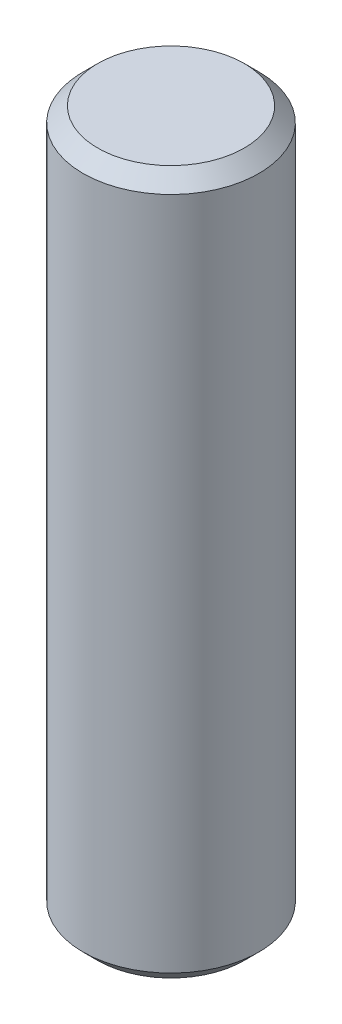
from build123d import *

# Parameters (mm, degrees)
SKETCH_1_W     = 1.5
SKETCH_1_H     = 12
CHAMFER_1_SIZE = 0.25


with BuildPart() as part:
    # 草图1 → 旋转1 (revolve)
    with BuildSketch(Plane.XY, mode=Mode.PRIVATE) as revolve_1_sk:
        with Locations((0.75, 6)):
            Rectangle(SKETCH_1_W, SKETCH_1_H)
    revolve(revolve_1_sk.sketch.rotate(Axis((0, 8.633805203, 0), (0, -1, 0)), 90), axis=Axis((0, 8.633805203, 0), (0, -1, 0)))

    # 倒角1
    chamfer_1_edges = [part.edges().sort_by_distance(p)[0] for p in [
        (0, 12, -1.5),
        (0, 0, -1.5),
    ]]
    chamfer(chamfer_1_edges, length=CHAMFER_1_SIZE)


solid = part.part
